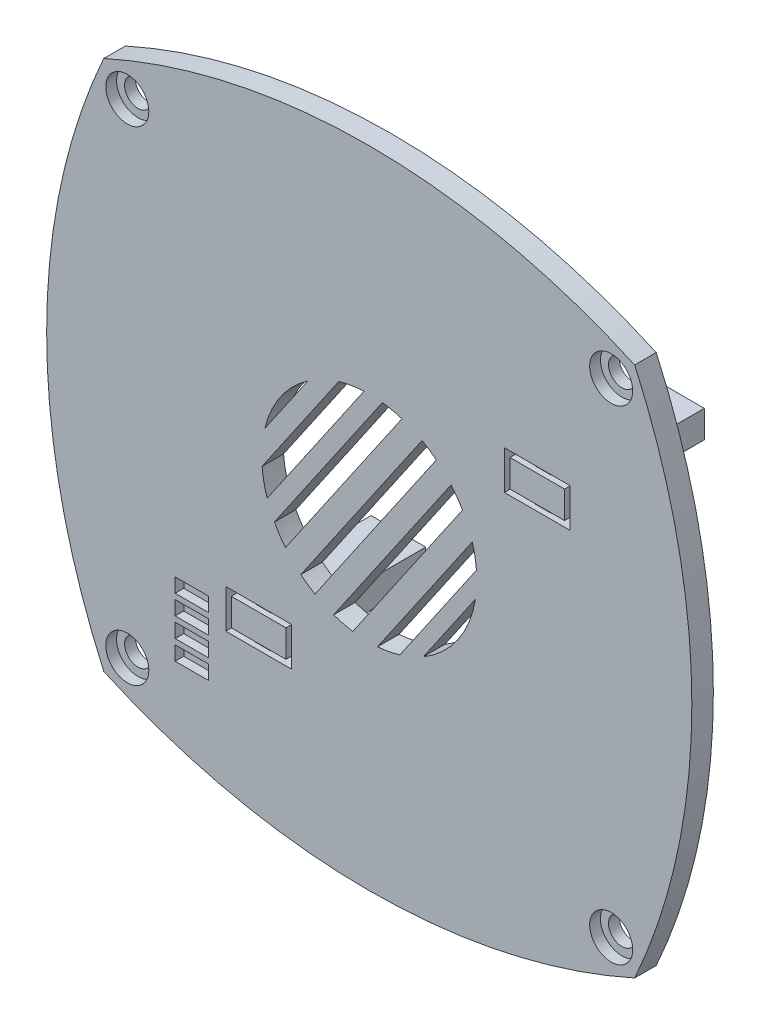
from build123d import *

# Parameters (mm, degrees)
EXTRUDE_1_DEPTH     = 2
SKETCH_3_R          = 1.25
CUT_EXTRUDE_1_DEPTH = 2
SKETCH_4_R          = 2
CUT_EXTRUDE_2_DEPTH = 1
SKETCH_6_W          = 3.080004
SKETCH_6_H          = 6.793992
EXTRUDE_2_DEPTH     = 5
CUT_EXTRUDE_START   = -5
SKETCH_7_W          = 3.080004
SKETCH_7_H          = 0.5
CUT_EXTRUDE_4_DEPTH = 5
CUT_EXTRUDE_5_DEPTH = 5
SKETCH_9_W          = 3.080004
SKETCH_9_H          = 1.323498
CUT_EXTRUDE_6_DEPTH = 0.8
CUT_EXTRUDE_7_DEPTH = 3
SKETCH_11_W         = 1.5
SKETCH_11_H         = 0.5299964
SKETCH_11_H_2       = 0.5300218
CUT_EXTRUDE_8_DEPTH = 0.5
SKETCH_12_W         = 5.08
SKETCH_12_H         = 2.54
EXTRUDE_3_DEPTH     = 11


with BuildPart() as part:
    # 草图2 → 凸台-拉伸1 (new body)
    with BuildSketch(Plane.XY):
        with BuildLine():
            ThreePointArc((24.686269666, 24.686269666), (0, 30), (-24.686269666, 24.686269666))
            ThreePointArc((-24.686269666, 24.686269666), (-30, 0), (-24.686269666, -24.686269666))
            ThreePointArc((-24.686269666, -24.686269666), (0, -30), (24.686269666, -24.686269666))
            ThreePointArc((24.686269666, -24.686269666), (30, 0), (24.686269666, 24.686269666))
        make_face()
    extrude(amount=EXTRUDE_1_DEPTH)

    # 草图3 → 切除-拉伸1 (cut)
    with BuildSketch(Plane.XY.offset(2)):
        with Locations((-22.5, 22.5)):
            Circle(SKETCH_3_R)
        with Locations((22.5, 22.5)):
            Circle(SKETCH_3_R)
        with Locations((-22.5, -22.5)):
            Circle(SKETCH_3_R)
        with Locations((22.5, -22.5)):
            Circle(SKETCH_3_R)
    extrude(amount=-CUT_EXTRUDE_1_DEPTH, mode=Mode.SUBTRACT)

    # 草图4 → 切除-拉伸2 (cut)
    with BuildSketch(Plane.XY.offset(2)):
        with Locations((-22.5, 22.5)):
            Circle(SKETCH_4_R)
        with Locations((22.5, 22.5)):
            Circle(SKETCH_4_R)
        with Locations((22.5, -22.5)):
            Circle(SKETCH_4_R)
        with Locations((-22.5, -22.5)):
            Circle(SKETCH_4_R)
    extrude(amount=-CUT_EXTRUDE_2_DEPTH, mode=Mode.SUBTRACT)

    # 草图6 → 凸台-拉伸2 (add)
    with BuildSketch(Plane(origin=(0, 0, 0), x_dir=(-1, 0, 0), z_dir=(0, 0, -1))):
        with Locations((16.51, -17.145)):
            Rectangle(SKETCH_6_W, SKETCH_6_H)
    extrude(amount=EXTRUDE_2_DEPTH)

    # 草图7 → 切除-拉伸4 (cut)
    with BuildSketch(Plane(origin=(0, 0, -5), x_dir=(-1, 0, 0), z_dir=(0, 0, -1)).offset(CUT_EXTRUDE_START)):
        with Locations((16.51, -15.321502)):
            Rectangle(SKETCH_7_W, SKETCH_7_H)
        with Locations((16.51, -17.145)):
            Rectangle(SKETCH_7_W, SKETCH_7_H)
        with Locations((16.51, -18.968498)):
            Rectangle(SKETCH_7_W, SKETCH_7_H)
    extrude(amount=CUT_EXTRUDE_4_DEPTH, mode=Mode.SUBTRACT)

    # 草图8 → 切除-拉伸5 (cut)
    with BuildSketch(Plane.XY.offset(2)):
        with BuildLine():
            Line((4.91157439, 8.710708181), (-6.35957061, -7.717244434))
            ThreePointArc((-6.35957061, -7.717244434), (-5.720805987, -8.201974083), (-5.04525755, -8.633966427))
            Line((-5.04525755, -8.633966427), (6.239861639, 7.81435389))
            ThreePointArc((6.239861639, 7.81435389), (5.593701291, 8.289180048), (4.91157439, 8.710708181))
        make_face()
        with BuildLine():
            Line((-0.483946584, 9.988282921), (-9.493244962, -3.142976312))
            ThreePointArc((-9.493244962, -3.142976312), (-9.800391035, -1.988048178), (-9.967568149, -0.804726786))
            Line((-9.967568149, -0.804726786), (-2.836233135, 9.589357726))
            ThreePointArc((-2.836233135, 9.589357726), (-1.672029805, 9.859224936), (-0.483946584, 9.988282921))
        make_face()
        with BuildLine():
            Line((-5.705235003, 8.212812768), (-9.715721467, 2.367436669))
            ThreePointArc((-9.715721467, 2.367436669), (-8.245821975, 5.65742167), (-5.705235003, 8.212812768))
        make_face()
        with BuildLine():
            Line((9.578841572, 2.871549083), (0.767992477, -9.970465764))
            ThreePointArc((0.767992477, -9.970465764), (1.815657886, -9.833788001), (2.843055403, -9.587337272))
            Line((2.843055403, -9.587337272), (9.968138202, 0.797634494))
            ThreePointArc((9.968138202, 0.797634494), (9.828345995, 1.844888885), (9.578841572, 2.871549083))
        make_face()
        with BuildLine():
            Line((9.873157751, -1.587688896), (5.034385744, -8.64031019))
            ThreePointArc((5.034385744, -8.64031019), (8.245821975, -5.65742167), (9.873157751, -1.587688896))
        make_face()
        with BuildLine():
            Line((1.224216457, 9.924781815), (-8.819278945, -4.713843325))
            ThreePointArc((-8.819278945, -4.713843325), (-8.34274934, -5.513486506), (-7.793929004, -6.265354793))
            Line((-7.793929004, -6.265354793), (3.040773833, 9.52647335))
            ThreePointArc((3.040773833, 9.52647335), (2.141774487, 9.767947689), (1.224216457, 9.924781815))
        make_face()
        with BuildLine():
            Line((8.668880472, 4.985028723), (-1.53135707, -9.882051686))
            ThreePointArc((-1.53135707, -9.882051686), (-2.432490647, -9.699638614), (-3.313061985, -9.435232921))
            Line((-3.313061985, -9.435232921), (7.610812743, 6.4865653))
            ThreePointArc((7.610812743, 6.4865653), (8.174396358, 5.760142723), (8.668880472, 4.985028723))
        make_face()
    extrude(amount=-CUT_EXTRUDE_5_DEPTH, mode=Mode.SUBTRACT)

    # 草图9 → 切除-拉伸6 (cut)
    with BuildSketch(Plane.XY.offset(2)):
        with Locations((-16.51, -14.409753)):
            Rectangle(SKETCH_9_W, SKETCH_9_H)
        with Locations((-16.51, -16.233251)):
            Rectangle(SKETCH_9_W, SKETCH_9_H)
        with Locations((-16.51, -18.056749)):
            Rectangle(SKETCH_9_W, SKETCH_9_H)
        with Locations((-16.51, -19.880247)):
            Rectangle(SKETCH_9_W, SKETCH_9_H)
    extrude(amount=-CUT_EXTRUDE_6_DEPTH, mode=Mode.SUBTRACT)

    # 草图10 → 切除-拉伸7 (cut)
    with BuildSketch(Plane.XY.offset(2)):
        Polygon((-11.1005, -12.1700036), (-11.1005, -12.7), (-12.827, -12.7), (-12.827, -15.24), (-11.1005, -15.24), (-11.1005, -15.7700218), (-13.3369812, -15.7700218), (-13.3369812, -12.1700036), align=None)
        Polygon((-7.2369934, -12.1700036), (-7.2369934, -15.7700218), (-9.6005, -15.7700218), (-9.6005, -15.24), (-7.747, -15.24), (-7.747, -12.7), (-9.6005, -12.7), (-9.6005, -12.1700036), align=None)
        Polygon((12.5709934, 11.9600218), (14.9345, 11.9600218), (14.9345, 11.43), (13.081, 11.43), (13.081, 8.89), (14.9345, 8.89), (14.9345, 8.3600036), (12.5709934, 8.3600036), align=None)
        Polygon((18.6709812, 11.9600218), (18.6709812, 8.3600036), (16.4345, 8.3600036), (16.4345, 8.89), (18.161, 8.89), (18.161, 11.43), (16.4345, 11.43), (16.4345, 11.9600218), align=None)
    extrude(amount=-CUT_EXTRUDE_7_DEPTH, mode=Mode.SUBTRACT)

    # 草图11 → 切除-拉伸8 (cut)
    with BuildSketch(Plane.XY.offset(2)):
        with Locations((-10.3505, -12.4350018)):
            Rectangle(SKETCH_11_W, SKETCH_11_H)
        with Locations((-10.3505, -15.5050109)):
            Rectangle(SKETCH_11_W, SKETCH_11_H_2)
        with Locations((15.6845, 11.6950109)):
            Rectangle(SKETCH_11_W, SKETCH_11_H_2)
        with Locations((15.6845, 8.6250018)):
            Rectangle(SKETCH_11_W, SKETCH_11_H)
    extrude(amount=-CUT_EXTRUDE_8_DEPTH, mode=Mode.SUBTRACT)

    # 草图12 → 凸台-拉伸3 (add)
    with BuildSketch(Plane(origin=(0, 0, 0), x_dir=(-1, 0, 0), z_dir=(0, 0, -1))):
        with Locations((-15.621, 10.16)):
            Rectangle(SKETCH_12_W, SKETCH_12_H)
        with Locations((10.287, -13.97)):
            Rectangle(SKETCH_12_W, SKETCH_12_H)
    extrude(amount=EXTRUDE_3_DEPTH)


solid = part.part
